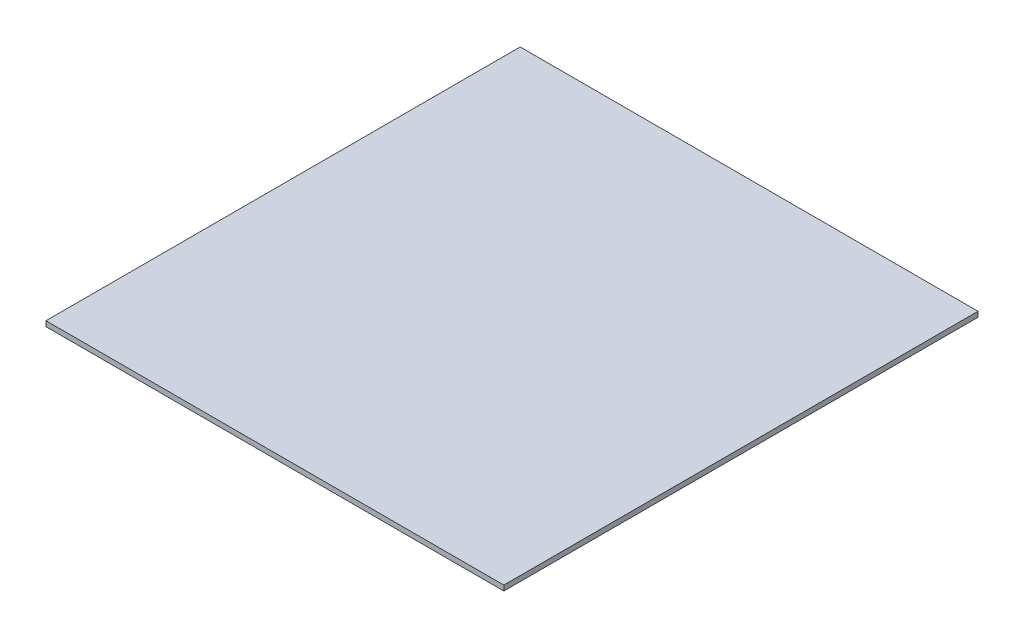
from build123d import *

# Parameters (mm, degrees)
SKETCH1_W           = 280
SKETCH1_H           = 3.175
BOSS_EXTRUDE1_DEPTH = 290


with BuildPart() as part:
    # Sketch1 → Boss-Extrude1 (new body)
    with BuildSketch(Plane.XY):
        Rectangle(SKETCH1_W, SKETCH1_H)
    extrude(amount=BOSS_EXTRUDE1_DEPTH)


solid = part.part
